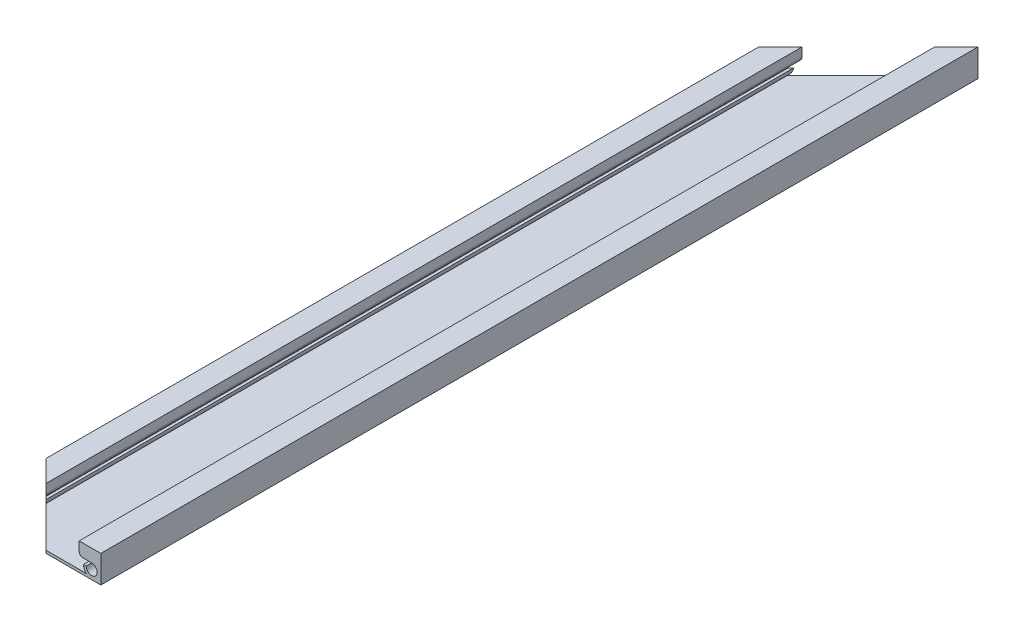
from build123d import *

# Parameters (mm, degrees)
SKETCH_1_W               = 60
SKETCH_1_H               = 15
EXTRUDE_1_DEPTH          = 510
SKETCH_2_R               = 3
CUT_EXTRUDE_1_DEPTH      = 511.936639908
CUT_EXTRUDE_2_DEPTH      = 511.936639908
SKETCH_4_W               = 36.3
SKETCH_4_H               = 7
CUT_EXTRUDE_3_DEPTH      = 511.936639908
FILLET_1_R               = 2
CUT_EXTRUDE_4_DEPTH      = 512.101751122
CUT_EXTRUDE_6_DEPTH      = 512.101751122
CUT_EXTRUDE_6_DEPTH_BACK = 512.101751122
SKETCH_7_W               = 30
SKETCH_7_H               = 30


with BuildPart() as part:
    # 스케치1 → 보스-돌출1 (new body)
    with BuildSketch(Plane.XY):
        Rectangle(SKETCH_1_W, SKETCH_1_H)
    extrude(amount=EXTRUDE_1_DEPTH)

    # 스케치2 → 컷-돌출1 (cut, through all)
    with BuildSketch(Plane(origin=(0, 0, 0), x_dir=(-1, 0, 0), z_dir=(0, 0, -1))):
        with Locations((-25, -2.5)):
            Circle(SKETCH_2_R)
        with Locations((25, -2.5)):
            Circle(SKETCH_2_R)
    extrude(amount=-CUT_EXTRUDE_1_DEPTH, mode=Mode.SUBTRACT)

    # 스케치3 → 컷-돌출2 (cut, through all)
    with BuildSketch(Plane(origin=(0, 0, 0), x_dir=(-1, 0, 0), z_dir=(0, 0, -1))):
        with BuildLine():
            Line((-22.171572875, -6), (22.171572875, -6))
            ThreePointArc((22.171572875, -6), (20.939339828, -4.439339828), (20.5, -2.5))
            Line((20.5, -2.5), (25, -2.5))
            Line((25, -2.5), (25, 0.5))
            Line((25, 0.5), (-25, 0.5))
            Line((-25, 0.5), (-25, -2.5))
            Line((-25, -2.5), (-20.5, -2.5))
            ThreePointArc((-20.5, -2.5), (-20.939339828, -4.439339828), (-22.171572875, -6))
        make_face()
    extrude(amount=-CUT_EXTRUDE_2_DEPTH, mode=Mode.SUBTRACT)

    # 스케치4 → 컷-돌출3 (cut, through all)
    with BuildSketch(Plane(origin=(0, 0, 0), x_dir=(-1, 0, 0), z_dir=(0, 0, -1))):
        with Locations((0.006888359, 4)):
            Rectangle(SKETCH_4_W, SKETCH_4_H)
    extrude(amount=-CUT_EXTRUDE_3_DEPTH, mode=Mode.SUBTRACT)

    # 필렛1
    fillet_1_edges = [part.edges().sort_by_distance(p)[0] for p in [
        (-18.156888359, 0.5, 255),
        (18.143111641, 0.5, 255),
    ]]
    fillet(fillet_1_edges, radius=FILLET_1_R)

    # 스케치5 → 컷-돌출4 (cut, through all)
    with BuildSketch(Plane.XZ.offset(7.5)):
        Polygon((-30, 510), (-30, 450), (30, 510), align=None)
        Polygon((-30, 0), (30, 0), (-30, 60), align=None)
    extrude(amount=-CUT_EXTRUDE_4_DEPTH, mode=Mode.SUBTRACT)

    # 스케치7 → 컷-돌출6 (cut, two sides: drawn at the far end of the back side and taken through both)
    with BuildSketch(Plane.XZ.offset(7.5).offset(-CUT_EXTRUDE_6_DEPTH_BACK)):
        with Locations((15, 495)):
            Rectangle(SKETCH_7_W, SKETCH_7_H)
    extrude(amount=CUT_EXTRUDE_6_DEPTH + CUT_EXTRUDE_6_DEPTH_BACK, mode=Mode.SUBTRACT)


solid = part.part
